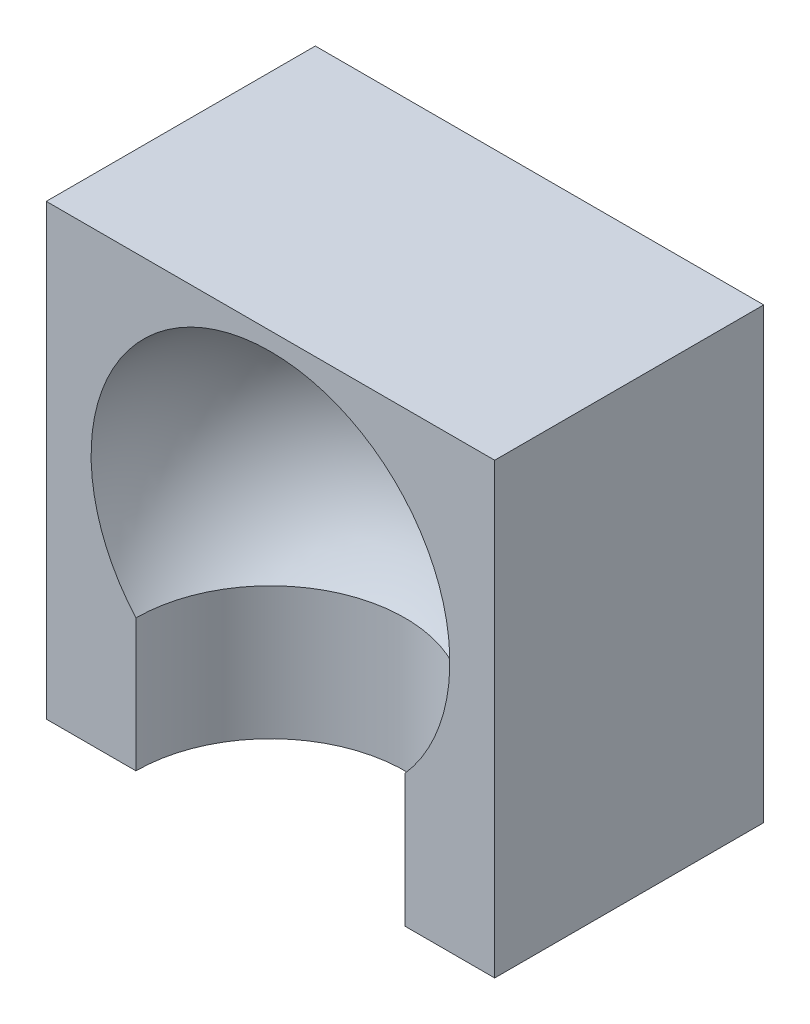
from build123d import *

# Parameters (mm, degrees)
SKETCH1_W           = 25
SKETCH1_H           = 25
BOSS_EXTRUDE1_DEPTH = 15
SKETCH3_R           = 7.5
CUT_EXTRUDE1_DEPTH  = 15


with BuildPart() as part:
    # Sketch1 → Boss-Extrude1 (new body)
    with BuildSketch(Plane.XY):
        with Locations((12.5, 12.5)):
            Rectangle(SKETCH1_W, SKETCH1_H)
    extrude(amount=BOSS_EXTRUDE1_DEPTH)

    # Sketch2 → Cut-Revolve2 (revolve, cut)
    with BuildSketch(Plane.XY.offset(15)):
        with BuildLine():
            Line((12.5, 24), (12.5, 4))
            ThreePointArc((12.5, 4), (22.5, 14), (12.5, 24))
        make_face()
    revolve(axis=Axis((12.5, 24, 15), (0, -1, 0)), mode=Mode.SUBTRACT)

    # Sketch3 → Cut-Extrude1 (cut)
    with BuildSketch(Plane.XZ):
        with Locations((12.5, 15)):
            Circle(SKETCH3_R)
    extrude(amount=-CUT_EXTRUDE1_DEPTH, mode=Mode.SUBTRACT)


solid = part.part
